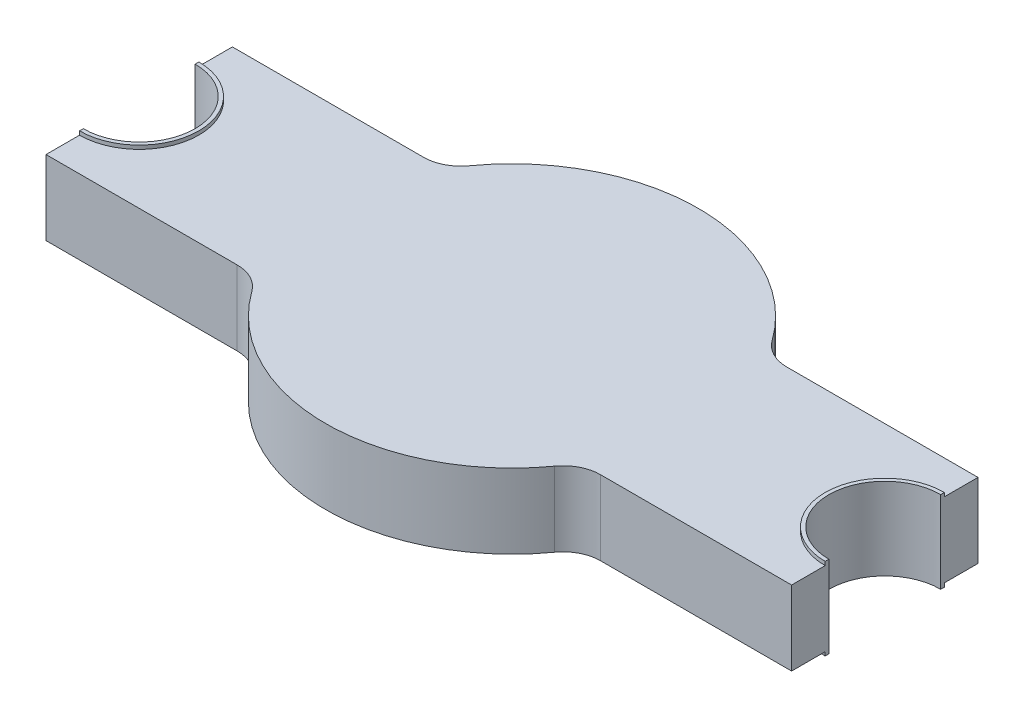
from build123d import *
from build123d.topology import SkipClean

# Parameters (mm, degrees)
EXTRUDE_1_DEPTH      = 20
FILLET_1_R           = 10
FILLET_2_R           = 10
SKETCH_3_R           = 15
CUT_EXTRUDE_1_DEPTH  = 20
EXTRUDE_2_DEPTH      = 21
EXTRUDE_2_DEPTH_BACK = 1
SKETCH_2_R           = 40
CUT_EXTRUDE_2_DEPTH  = 15
SKETCH_5_R           = 30
EXTRUDE_3_DEPTH      = 15
SKETCH_5_3_R         = 15
SKETCH_5_3_R_2       = 10
EXTRUDE_4_DEPTH      = 10


with BuildPart() as part:
    # 草图1 → 凸台-拉伸1 (new body)
    with BuildSketch(Plane(origin=(0, 0, 0), x_dir=(1, 0, 0), z_dir=(0, 1, 0))):
        with BuildLine():
            Line((-100, 25), (-100, -25))
            Line((-100, -25), (-43.301270189, -25))
            ThreePointArc((-43.301270189, -25), (0, -50), (43.301270189, -25))
            Line((43.301270189, -25), (100, -25))
            Line((100, -25), (100, 25))
            Line((100, 25), (43.301270189, 25))
            ThreePointArc((43.301270189, 25), (0, 50), (-43.301270189, 25))
            Line((-43.301270189, 25), (-100, 25))
        make_face()
    extrude(amount=EXTRUDE_1_DEPTH)

    # 圆角1
    fillet_1_edges = [part.edges().sort_by_distance(p)[0] for p in [
        (-43.301270189, 10, 25),
    ]]
    fillet(fillet_1_edges, radius=FILLET_1_R)

    # 圆角2
    fillet_2_edges = [part.edges().sort_by_distance(p)[0] for p in [
        (43.301270189, 10, 25),
        (43.301270189, 10, -25),
        (-43.301270189, 10, -25),
    ]]
    fillet(fillet_2_edges, radius=FILLET_2_R)

    # 草图3 → 切除-拉伸1 (cut)
    with BuildSketch(Plane(origin=(0, 0, 0), x_dir=(1, 0, 0), z_dir=(0, 1, 0))):
        with Locations((-100, 0)):
            Circle(SKETCH_3_R)
        with Locations((100, 0)):
            Circle(SKETCH_3_R)
    extrude(amount=CUT_EXTRUDE_1_DEPTH, mode=Mode.SUBTRACT)

    # 草图4 → 凸台-拉伸2 (add, two sides: drawn at the far end of the back side and taken through both)
    with BuildSketch(Plane(origin=(0, 0, 0), x_dir=(1, 0, 0), z_dir=(0, 1, 0)).offset(-EXTRUDE_2_DEPTH_BACK)):
        with BuildLine():
            ThreePointArc((-100, -16), (-84, 0), (-100, 16))
            Line((-100, 16), (-100, 15))
            ThreePointArc((-100, 15), (-85, 0), (-100, -15))
            Line((-100, -15), (-100, -16))
        make_face()
        with BuildLine():
            Line((100, -16), (100, -15))
            ThreePointArc((100, -15), (85, 0), (100, 15))
            Line((100, 15), (100, 16))
            ThreePointArc((100, 16), (84, 0), (100, -16))
        make_face()
    extrude(amount=EXTRUDE_2_DEPTH + EXTRUDE_2_DEPTH_BACK)

    # 草图2 → 切除-拉伸2 (cut)
    with SkipClean():  # the faces are left unmerged after this step: merging them gives an invalid solid
        with BuildSketch(Plane(origin=(0, 0, 0), x_dir=(1, 0, 0), z_dir=(0, 1, 0))):
            Circle(SKETCH_2_R)
        extrude(amount=CUT_EXTRUDE_2_DEPTH, mode=Mode.SUBTRACT)

    # 草图5 → 凸台-拉伸3 (add)
    with SkipClean():  # the faces are left unmerged after this step: merging them gives an invalid solid
        with BuildSketch(Plane(origin=(0, 0, 0), x_dir=(1, 0, 0), z_dir=(0, 1, 0))):
            Circle(SKETCH_5_R)
        extrude(amount=EXTRUDE_3_DEPTH)

    # 草图5<3> → 凸台-拉伸4 (add)
    with SkipClean():  # the faces are left unmerged after this step: merging them gives an invalid solid
        with BuildSketch(Plane(origin=(0, 0, 0), x_dir=(1, 0, 0), z_dir=(0, 1, 0))):
            Circle(SKETCH_5_3_R)
            Circle(SKETCH_5_3_R_2, mode=Mode.SUBTRACT)
        extrude(amount=-EXTRUDE_4_DEPTH)


solid = part.part
